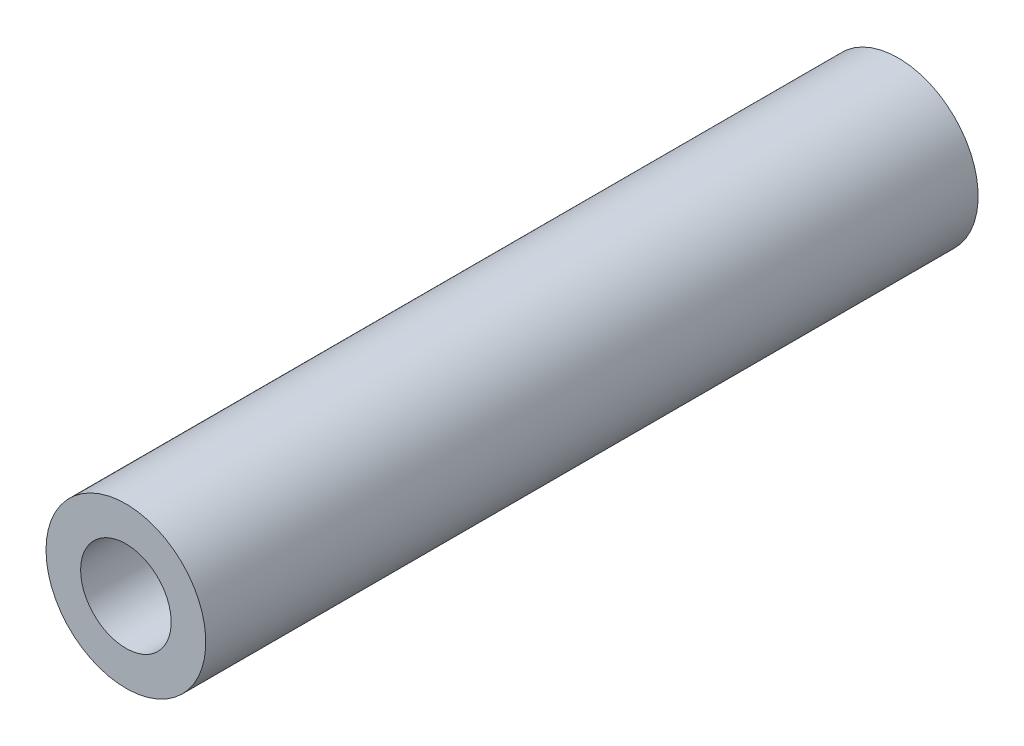
from build123d import *

# Parameters (mm, degrees)
SKETCH1_R           = 3
SKETCH1_R_2         = 1.7
RING_ENVELOPE_DEPTH = 29


with BuildPart() as part:
    # Sketch1 → Ring_Envelope (new body)
    with BuildSketch(Plane.XY):
        with Locations(Location((0, 0, 0), (0, 0, 180))):
            Circle(SKETCH1_R)
        with Locations(Location((0, 0, 0), (0, 0, 180))):
            Circle(SKETCH1_R_2, mode=Mode.SUBTRACT)
    extrude(amount=RING_ENVELOPE_DEPTH)


solid = part.part
